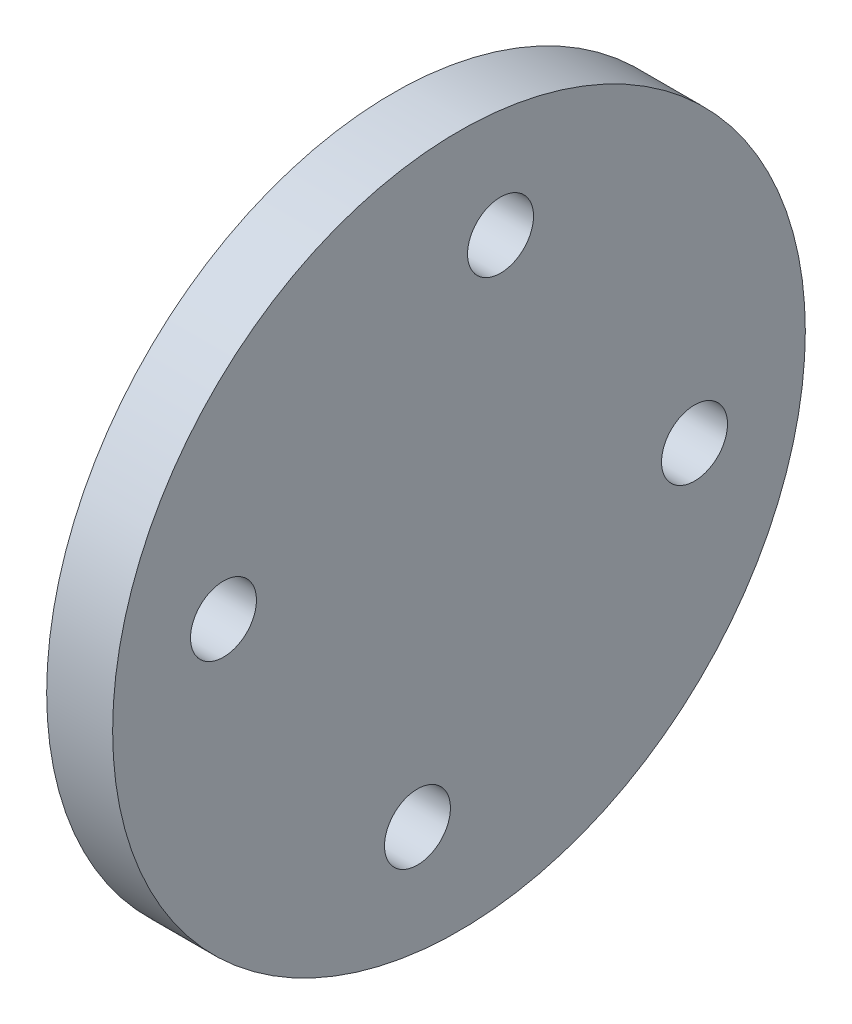
from build123d import *

# Parameters (mm, degrees)
SKETCH1_R           = 10.5
SKETCH1_R_2         = 1
BOSS_EXTRUDE1_DEPTH = 2


with BuildPart() as part:
    # Sketch1 → Boss-Extrude1 (new body)
    with BuildSketch(Plane(origin=(48, 0, 0), x_dir=(0, -1, 0), z_dir=(-1, 0, 0))):
        with Locations(Location((2.356083365, -40.657629982, 0), (0, 0, 270))):
            Circle(SKETCH1_R)
        with Locations(Location((-4.783772844, -41.91657927, 0), (0, 0, 270))):
            Circle(SKETCH1_R_2, mode=Mode.SUBTRACT)
        with Locations(Location((9.495939574, -39.398680694, 0), (0, 0, 270))):
            Circle(SKETCH1_R_2, mode=Mode.SUBTRACT)
        with Locations(Location((1.097134077, -33.517773772, 0), (0, 0, 270))):
            Circle(SKETCH1_R_2, mode=Mode.SUBTRACT)
        with Locations(Location((3.615032653, -47.797486191, 0), (0, 0, 270))):
            Circle(SKETCH1_R_2, mode=Mode.SUBTRACT)
    extrude(amount=-BOSS_EXTRUDE1_DEPTH)


solid = part.part
